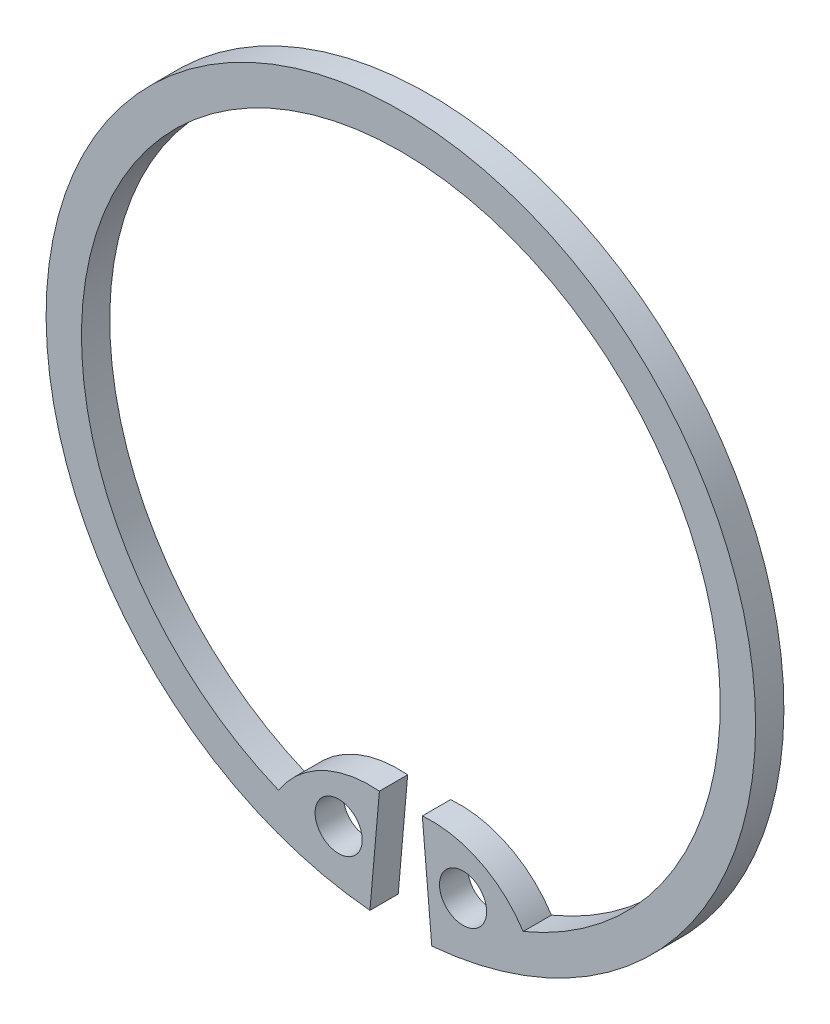
from build123d import *

# Parameters (mm, degrees)
SKETCH_1_R      = 1
EXTRUDE_1_DEPTH = 1.2


with BuildPart() as part:
    # 草图1 → 凸台-拉伸1 (new body)
    with BuildSketch(Plane.XY):
        with BuildLine():
            Line((-1.311693928, -14.992730206), (-0.910777512, -10.410234595))
            ThreePointArc((-0.910777512, -10.410234595), (-3.344099952, -10.866069843), (-5.188750407, -12.517162986))
            ThreePointArc((-5.188750407, -12.517162986), (0, 13.55), (5.188750407, -12.517162986))
            ThreePointArc((5.188750407, -12.517162986), (3.344099952, -10.866069843), (0.910777512, -10.410234595))
            Line((0.910777512, -10.410234595), (1.311693928, -14.992730206))
            ThreePointArc((1.311693928, -14.992730206), (0, 15.05), (-1.311693928, -14.992730206))
        make_face()
        with Locations((2.638734257, -12.567843595)):
            Circle(SKETCH_1_R, mode=Mode.SUBTRACT)
        with Locations((-2.638734257, -12.567843595)):
            Circle(SKETCH_1_R, mode=Mode.SUBTRACT)
    extrude(amount=EXTRUDE_1_DEPTH)


solid = part.part
